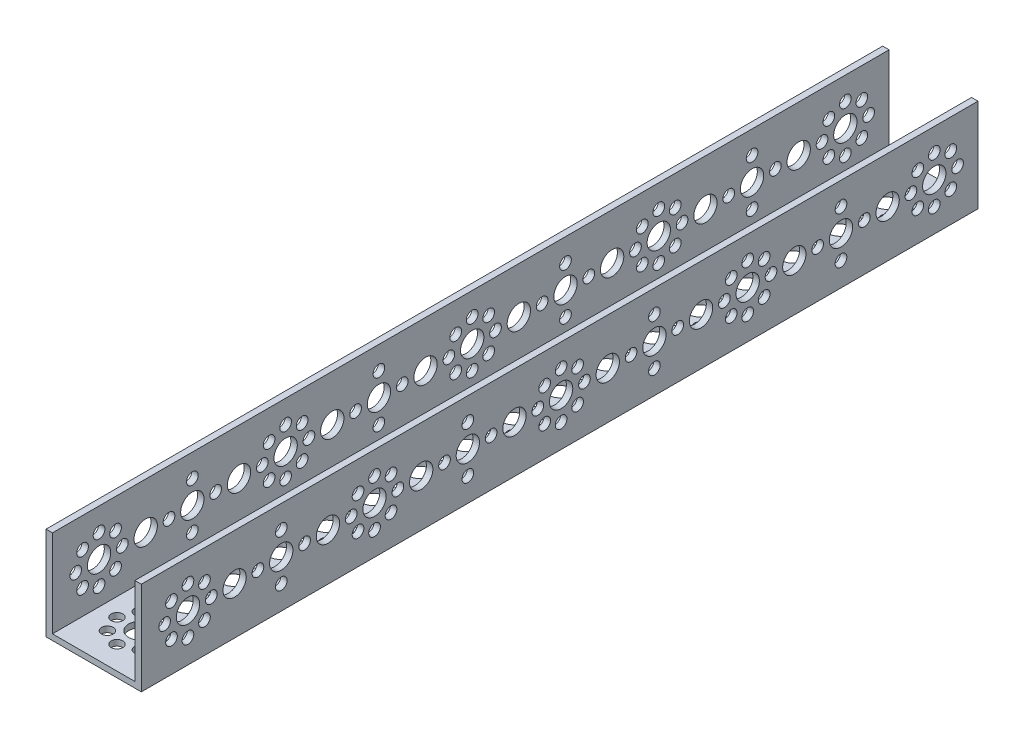
from build123d import *

# Parameters (mm, degrees)
BOSS_EXTRU_1_DEPTH                    = 287
ESQUISSE2_R                           = 4
ENL_V_MAT_EXTRU_1_DEPTH               = 291.623966665
R_P_TITION_LIN_AIRE1_COUNT            = 17
R_P_TITION_LIN_AIRE1_PITCH            = 16
ESQUISSE3_R                           = 2
ENL_V_MAT_EXTRU_2_DEPTH               = 291.623966665
R_P_TITION_CIRCULAIRE1_COUNT          = 4
R_P_TITION_CIRCULAIRE2_COUNT          = 8
R_P_TITION_LIN_AIRE2_COUNT            = 17
R_P_TITION_LIN_AIRE2_PITCH            = 16
R_P_TITION_LIN_AIRE2_COPY_1_SKETCH_R  = 2
R_P_TITION_LIN_AIRE2_COPY_1_DEPTH     = 291.623966665
R_P_TITION_LIN_AIRE2_COPY_2_SKETCH_R  = 2
R_P_TITION_LIN_AIRE2_COPY_2_DEPTH     = 291.623966665
R_P_TITION_LIN_AIRE2_COPY_3_SKETCH_R  = 2
R_P_TITION_LIN_AIRE2_COPY_3_DEPTH     = 291.623966665
R_P_TITION_LIN_AIRE2_COPY_4_SKETCH_R  = 2
R_P_TITION_LIN_AIRE2_COPY_4_DEPTH     = 291.623966665
R_P_TITION_LIN_AIRE2_COPY_5_SKETCH_R  = 2
R_P_TITION_LIN_AIRE2_COPY_5_DEPTH     = 291.623966665
R_P_TITION_LIN_AIRE2_COPY_6_SKETCH_R  = 2
R_P_TITION_LIN_AIRE2_COPY_6_DEPTH     = 291.623966665
R_P_TITION_LIN_AIRE2_COPY_7_SKETCH_R  = 2
R_P_TITION_LIN_AIRE2_COPY_7_DEPTH     = 291.623966665
R_P_TITION_LIN_AIRE2_COPY_8_SKETCH_R  = 2
R_P_TITION_LIN_AIRE2_COPY_8_DEPTH     = 291.623966665
R_P_TITION_LIN_AIRE2_COPY_9_SKETCH_R  = 2
R_P_TITION_LIN_AIRE2_COPY_9_DEPTH     = 291.623966665
R_P_TITION_LIN_AIRE2_COPY_10_SKETCH_R = 2
R_P_TITION_LIN_AIRE2_COPY_10_DEPTH    = 291.623966665
R_P_TITION_LIN_AIRE2_COPY_11_SKETCH_R = 2
R_P_TITION_LIN_AIRE2_COPY_11_DEPTH    = 291.623966665
R_P_TITION_LIN_AIRE2_COPY_12_SKETCH_R = 2
R_P_TITION_LIN_AIRE2_COPY_12_DEPTH    = 291.623966665
R_P_TITION_LIN_AIRE2_COPY_13_SKETCH_R = 2
R_P_TITION_LIN_AIRE2_COPY_13_DEPTH    = 291.623966665
R_P_TITION_LIN_AIRE2_COPY_14_SKETCH_R = 2
R_P_TITION_LIN_AIRE2_COPY_14_DEPTH    = 291.623966665
R_P_TITION_LIN_AIRE2_COPY_15_SKETCH_R = 2
R_P_TITION_LIN_AIRE2_COPY_15_DEPTH    = 291.623966665
R_P_TITION_LIN_AIRE2_COPY_16_SKETCH_R = 2
R_P_TITION_LIN_AIRE2_COPY_16_DEPTH    = 291.623966665
R_P_TITION_LIN_AIRE2_COPY_17_SKETCH_R = 2
R_P_TITION_LIN_AIRE2_COPY_17_DEPTH    = 291.623966665
R_P_TITION_LIN_AIRE2_COPY_18_SKETCH_R = 2
R_P_TITION_LIN_AIRE2_COPY_18_DEPTH    = 291.623966665
R_P_TITION_LIN_AIRE2_COPY_19_SKETCH_R = 2
R_P_TITION_LIN_AIRE2_COPY_19_DEPTH    = 291.623966665
R_P_TITION_LIN_AIRE2_COPY_20_SKETCH_R = 2
R_P_TITION_LIN_AIRE2_COPY_20_DEPTH    = 291.623966665
R_P_TITION_LIN_AIRE2_COPY_21_SKETCH_R = 2
R_P_TITION_LIN_AIRE2_COPY_21_DEPTH    = 291.623966665
R_P_TITION_LIN_AIRE2_COPY_22_SKETCH_R = 2
R_P_TITION_LIN_AIRE2_COPY_22_DEPTH    = 291.623966665
R_P_TITION_LIN_AIRE2_COPY_23_SKETCH_R = 2
R_P_TITION_LIN_AIRE2_COPY_23_DEPTH    = 291.623966665
R_P_TITION_LIN_AIRE2_COPY_24_SKETCH_R = 2
R_P_TITION_LIN_AIRE2_COPY_24_DEPTH    = 291.623966665
R_P_TITION_LIN_AIRE3_COPY_1_SKETCH_R  = 2
R_P_TITION_LIN_AIRE3_COPY_1_DEPTH     = 291.623966665
R_P_TITION_LIN_AIRE3_COPY_2_SKETCH_R  = 2
R_P_TITION_LIN_AIRE3_COPY_2_DEPTH     = 291.623966665
R_P_TITION_LIN_AIRE3_COPY_3_SKETCH_R  = 2
R_P_TITION_LIN_AIRE3_COPY_3_DEPTH     = 291.623966665
R_P_TITION_LIN_AIRE3_COPY_4_SKETCH_R  = 2
R_P_TITION_LIN_AIRE3_COPY_4_DEPTH     = 291.623966665
R_P_TITION_LIN_AIRE3_COPY_5_SKETCH_R  = 2
R_P_TITION_LIN_AIRE3_COPY_5_DEPTH     = 291.623966665
R_P_TITION_LIN_AIRE3_COPY_6_SKETCH_R  = 2
R_P_TITION_LIN_AIRE3_COPY_6_DEPTH     = 291.623966665
R_P_TITION_LIN_AIRE3_COPY_7_SKETCH_R  = 2
R_P_TITION_LIN_AIRE3_COPY_7_DEPTH     = 291.623966665
R_P_TITION_LIN_AIRE3_COPY_8_SKETCH_R  = 2
R_P_TITION_LIN_AIRE3_COPY_8_DEPTH     = 291.623966665
R_P_TITION_LIN_AIRE3_COPY_9_SKETCH_R  = 2
R_P_TITION_LIN_AIRE3_COPY_9_DEPTH     = 291.623966665
R_P_TITION_LIN_AIRE3_COPY_10_SKETCH_R = 2
R_P_TITION_LIN_AIRE3_COPY_10_DEPTH    = 291.623966665
R_P_TITION_LIN_AIRE3_COPY_11_SKETCH_R = 2
R_P_TITION_LIN_AIRE3_COPY_11_DEPTH    = 291.623966665
R_P_TITION_LIN_AIRE3_COPY_12_SKETCH_R = 2
R_P_TITION_LIN_AIRE3_COPY_12_DEPTH    = 291.623966665
R_P_TITION_LIN_AIRE3_COPY_13_SKETCH_R = 2
R_P_TITION_LIN_AIRE3_COPY_13_DEPTH    = 291.623966665
R_P_TITION_LIN_AIRE3_COPY_14_SKETCH_R = 2
R_P_TITION_LIN_AIRE3_COPY_14_DEPTH    = 291.623966665
R_P_TITION_LIN_AIRE3_COPY_15_SKETCH_R = 2
R_P_TITION_LIN_AIRE3_COPY_15_DEPTH    = 291.623966665
R_P_TITION_LIN_AIRE3_COPY_16_SKETCH_R = 2
R_P_TITION_LIN_AIRE3_COPY_16_DEPTH    = 291.623966665
R_P_TITION_LIN_AIRE3_COPY_17_SKETCH_R = 2
R_P_TITION_LIN_AIRE3_COPY_17_DEPTH    = 291.623966665
R_P_TITION_LIN_AIRE3_COPY_18_SKETCH_R = 2
R_P_TITION_LIN_AIRE3_COPY_18_DEPTH    = 291.623966665
R_P_TITION_LIN_AIRE3_COPY_19_SKETCH_R = 2
R_P_TITION_LIN_AIRE3_COPY_19_DEPTH    = 291.623966665
R_P_TITION_LIN_AIRE3_COPY_20_SKETCH_R = 2
R_P_TITION_LIN_AIRE3_COPY_20_DEPTH    = 291.623966665
SYM_TRIE2_COPY_1_SKETCH_R             = 4
SYM_TRIE2_COPY_1_DEPTH                = 291.623966665
SYM_TRIE2_COPY_2_SKETCH_R             = 4
SYM_TRIE2_COPY_2_DEPTH                = 291.623966665
SYM_TRIE2_COPY_3_SKETCH_R             = 4
SYM_TRIE2_COPY_3_DEPTH                = 291.623966665
SYM_TRIE2_COPY_4_SKETCH_R             = 4
SYM_TRIE2_COPY_4_DEPTH                = 291.623966665
SYM_TRIE2_COPY_5_SKETCH_R             = 4
SYM_TRIE2_COPY_5_DEPTH                = 291.623966665
SYM_TRIE2_COPY_6_SKETCH_R             = 4
SYM_TRIE2_COPY_6_DEPTH                = 291.623966665
SYM_TRIE2_COPY_7_SKETCH_R             = 4
SYM_TRIE2_COPY_7_DEPTH                = 291.623966665
SYM_TRIE2_COPY_8_SKETCH_R             = 4
SYM_TRIE2_COPY_8_DEPTH                = 291.623966665
SYM_TRIE2_COPY_9_SKETCH_R             = 4
SYM_TRIE2_COPY_9_DEPTH                = 291.623966665
SYM_TRIE2_COPY_10_SKETCH_R            = 4
SYM_TRIE2_COPY_10_DEPTH               = 291.623966665
SYM_TRIE2_COPY_11_SKETCH_R            = 4
SYM_TRIE2_COPY_11_DEPTH               = 291.623966665
SYM_TRIE2_COPY_12_SKETCH_R            = 4
SYM_TRIE2_COPY_12_DEPTH               = 291.623966665
SYM_TRIE2_COPY_13_SKETCH_R            = 4
SYM_TRIE2_COPY_13_DEPTH               = 291.623966665
SYM_TRIE2_COPY_14_SKETCH_R            = 4
SYM_TRIE2_COPY_14_DEPTH               = 291.623966665
SYM_TRIE2_COPY_15_SKETCH_R            = 4
SYM_TRIE2_COPY_15_DEPTH               = 291.623966665
SYM_TRIE2_COPY_16_SKETCH_R            = 4
SYM_TRIE2_COPY_16_DEPTH               = 291.623966665
SYM_TRIE2_COPY_17_SKETCH_R            = 2
SYM_TRIE2_COPY_17_DEPTH               = 291.623966665
SYM_TRIE2_COPY_18_SKETCH_R            = 2
SYM_TRIE2_COPY_18_DEPTH               = 291.623966665
SYM_TRIE2_COPY_19_SKETCH_R            = 2
SYM_TRIE2_COPY_19_DEPTH               = 291.623966665
SYM_TRIE2_COPY_20_SKETCH_R            = 2
SYM_TRIE2_COPY_20_DEPTH               = 291.623966665
SYM_TRIE2_COPY_21_SKETCH_R            = 2
SYM_TRIE2_COPY_21_DEPTH               = 291.623966665
SYM_TRIE2_COPY_22_SKETCH_R            = 2
SYM_TRIE2_COPY_22_DEPTH               = 291.623966665
SYM_TRIE2_COPY_23_SKETCH_R            = 2
SYM_TRIE2_COPY_23_DEPTH               = 291.623966665
SYM_TRIE2_COPY_24_SKETCH_R            = 2
SYM_TRIE2_COPY_24_DEPTH               = 291.623966665
SYM_TRIE2_COPY_25_SKETCH_R            = 2
SYM_TRIE2_COPY_25_DEPTH               = 291.623966665
SYM_TRIE2_COPY_26_SKETCH_R            = 2
SYM_TRIE2_COPY_26_DEPTH               = 291.623966665
SYM_TRIE2_COPY_27_SKETCH_R            = 2
SYM_TRIE2_COPY_27_DEPTH               = 291.623966665
SYM_TRIE2_COPY_28_SKETCH_R            = 2
SYM_TRIE2_COPY_28_DEPTH               = 291.623966665
SYM_TRIE2_COPY_29_SKETCH_R            = 2
SYM_TRIE2_COPY_29_DEPTH               = 291.623966665
SYM_TRIE2_COPY_30_SKETCH_R            = 2
SYM_TRIE2_COPY_30_DEPTH               = 291.623966665
SYM_TRIE2_COPY_31_SKETCH_R            = 2
SYM_TRIE2_COPY_31_DEPTH               = 291.623966665
SYM_TRIE2_COPY_32_SKETCH_R            = 2
SYM_TRIE2_COPY_32_DEPTH               = 291.623966665
SYM_TRIE2_COPY_33_SKETCH_R            = 2
SYM_TRIE2_COPY_33_DEPTH               = 291.623966665
SYM_TRIE2_COPY_34_SKETCH_R            = 2
SYM_TRIE2_COPY_34_DEPTH               = 291.623966665
SYM_TRIE2_COPY_35_SKETCH_R            = 2
SYM_TRIE2_COPY_35_DEPTH               = 291.623966665
SYM_TRIE2_COPY_36_SKETCH_R            = 2
SYM_TRIE2_COPY_36_DEPTH               = 291.623966665
SYM_TRIE2_COPY_37_SKETCH_R            = 2
SYM_TRIE2_COPY_37_DEPTH               = 291.623966665
SYM_TRIE2_COPY_38_SKETCH_R            = 2
SYM_TRIE2_COPY_38_DEPTH               = 291.623966665
SYM_TRIE2_COPY_39_SKETCH_R            = 2
SYM_TRIE2_COPY_39_DEPTH               = 291.623966665
SYM_TRIE2_COPY_40_SKETCH_R            = 2
SYM_TRIE2_COPY_40_DEPTH               = 291.623966665
SYM_TRIE2_COPY_41_SKETCH_R            = 2
SYM_TRIE2_COPY_41_DEPTH               = 291.623966665
SYM_TRIE2_COPY_42_SKETCH_R            = 2
SYM_TRIE2_COPY_42_DEPTH               = 291.623966665
SYM_TRIE2_COPY_43_SKETCH_R            = 2
SYM_TRIE2_COPY_43_DEPTH               = 291.623966665
SYM_TRIE2_COPY_44_SKETCH_R            = 2
SYM_TRIE2_COPY_44_DEPTH               = 291.623966665
SYM_TRIE2_COPY_45_SKETCH_R            = 2
SYM_TRIE2_COPY_45_DEPTH               = 291.623966665
SYM_TRIE2_COPY_46_SKETCH_R            = 2
SYM_TRIE2_COPY_46_DEPTH               = 291.623966665
SYM_TRIE2_COPY_47_SKETCH_R            = 2
SYM_TRIE2_COPY_47_DEPTH               = 291.623966665
SYM_TRIE2_COPY_48_SKETCH_R            = 2
SYM_TRIE2_COPY_48_DEPTH               = 291.623966665
SYM_TRIE2_COPY_49_SKETCH_R            = 2
SYM_TRIE2_COPY_49_DEPTH               = 291.623966665
SYM_TRIE2_COPY_50_SKETCH_R            = 2
SYM_TRIE2_COPY_50_DEPTH               = 291.623966665
SYM_TRIE2_COPY_51_SKETCH_R            = 2
SYM_TRIE2_COPY_51_DEPTH               = 291.623966665
SYM_TRIE2_COPY_52_SKETCH_R            = 2
SYM_TRIE2_COPY_52_DEPTH               = 291.623966665
SYM_TRIE2_COPY_53_SKETCH_R            = 2
SYM_TRIE2_COPY_53_DEPTH               = 291.623966665
SYM_TRIE2_COPY_54_SKETCH_R            = 2
SYM_TRIE2_COPY_54_DEPTH               = 291.623966665
SYM_TRIE2_COPY_55_SKETCH_R            = 2
SYM_TRIE2_COPY_55_DEPTH               = 291.623966665
SYM_TRIE2_COPY_56_SKETCH_R            = 2
SYM_TRIE2_COPY_56_DEPTH               = 291.623966665
SYM_TRIE2_COPY_57_SKETCH_R            = 2
SYM_TRIE2_COPY_57_DEPTH               = 291.623966665
SYM_TRIE2_COPY_58_SKETCH_R            = 2
SYM_TRIE2_COPY_58_DEPTH               = 291.623966665
SYM_TRIE2_COPY_59_SKETCH_R            = 2
SYM_TRIE2_COPY_59_DEPTH               = 291.623966665
SYM_TRIE2_COPY_60_SKETCH_R            = 2
SYM_TRIE2_COPY_60_DEPTH               = 291.623966665
SYM_TRIE2_COPY_61_SKETCH_R            = 2
SYM_TRIE2_COPY_61_DEPTH               = 291.623966665
SYM_TRIE2_COPY_62_SKETCH_R            = 2
SYM_TRIE2_COPY_62_DEPTH               = 291.623966665
SYM_TRIE2_COPY_63_SKETCH_R            = 2
SYM_TRIE2_COPY_63_DEPTH               = 291.623966665
SYM_TRIE2_COPY_64_SKETCH_R            = 2
SYM_TRIE2_COPY_64_DEPTH               = 291.623966665
SYM_TRIE2_COPY_65_SKETCH_R            = 2
SYM_TRIE2_COPY_65_DEPTH               = 291.623966665
SYM_TRIE2_COPY_66_SKETCH_R            = 2
SYM_TRIE2_COPY_66_DEPTH               = 291.623966665
SYM_TRIE2_COPY_67_SKETCH_R            = 2
SYM_TRIE2_COPY_67_DEPTH               = 291.623966665
SYM_TRIE2_COPY_68_SKETCH_R            = 2
SYM_TRIE2_COPY_68_DEPTH               = 291.623966665
SYM_TRIE2_COPY_69_SKETCH_R            = 2
SYM_TRIE2_COPY_69_DEPTH               = 291.623966665
SYM_TRIE2_COPY_70_SKETCH_R            = 2
SYM_TRIE2_COPY_70_DEPTH               = 291.623966665
SYM_TRIE2_COPY_71_SKETCH_R            = 2
SYM_TRIE2_COPY_71_DEPTH               = 291.623966665
SYM_TRIE2_COPY_72_SKETCH_R            = 2
SYM_TRIE2_COPY_72_DEPTH               = 291.623966665
SYM_TRIE2_COPY_73_SKETCH_R            = 2
SYM_TRIE2_COPY_73_DEPTH               = 291.623966665
SYM_TRIE2_COPY_74_SKETCH_R            = 2
SYM_TRIE2_COPY_74_DEPTH               = 291.623966665
SYM_TRIE2_COPY_75_SKETCH_R            = 2
SYM_TRIE2_COPY_75_DEPTH               = 291.623966665


with BuildPart() as part:
    # Esquisse1 → Boss.-Extru.1 (new body)
    with BuildSketch(Plane.XY):
        Polygon((0, 0), (0, 32), (2.2, 32), (2.2, 2), (30.5, 2), (30.5, 32), (32.7, 32), (32.7, 0), align=None)
    extrude(amount=BOSS_EXTRU_1_DEPTH)

    # Esquisse2 → Enlèv. mat.-Extru.1 (cut, symmetric)
    with BuildSketch(Plane(origin=(0, 0, 0), x_dir=(-1, 0, 0), z_dir=(0, -1, 0))):
        with Locations(Location((-16.35, -271, 0), (0, 0, 90))):
            Circle(ESQUISSE2_R)
    enl_v_mat_extru_1 = extrude(amount=ENL_V_MAT_EXTRU_1_DEPTH, both=True, mode=Mode.SUBTRACT)

    # Répétition linéaire1: Enlèv. mat.-Extru.1 ×17
    with Locations(*[(0, 0, -i * R_P_TITION_LIN_AIRE1_PITCH) for i in range(1, R_P_TITION_LIN_AIRE1_COUNT)]):
        add(enl_v_mat_extru_1, mode=Mode.SUBTRACT)

    # Esquisse3 → Enlèv. mat.-Extru.2 (cut, symmetric)
    with BuildSketch(Plane.XZ):
        with Locations(Location((24.35, 271, 0), (0, 0, 270))):
            Circle(ESQUISSE3_R)
    enl_v_mat_extru_2 = extrude(amount=ENL_V_MAT_EXTRU_2_DEPTH, both=True, mode=Mode.SUBTRACT)

    # Répétition circulaire1: Enlèv. mat.-Extru.2 ×4 about axis
    r_p_tition_circulaire1_axis = Axis((16.35, 0, 271), (0, 1, 0))
    for i in range(1, R_P_TITION_CIRCULAIRE1_COUNT):
        add(enl_v_mat_extru_2.rotate(r_p_tition_circulaire1_axis, i * 360 / R_P_TITION_CIRCULAIRE1_COUNT), mode=Mode.SUBTRACT)

    # Répétition circulaire2: Enlèv. mat.-Extru.2 ×8 about axis, 3 skipped
    r_p_tition_circulaire2_axis = Axis((16.35, 0, 271), (0, 1, 0))
    add([enl_v_mat_extru_2.rotate(r_p_tition_circulaire2_axis, i * 360 / R_P_TITION_CIRCULAIRE2_COUNT) for i in range(1, R_P_TITION_CIRCULAIRE2_COUNT) if i not in (2, 4, 6)], mode=Mode.SUBTRACT)

    # Répétition linéaire2: Enlèv. mat.-Extru.2 ×17, 8 skipped
    with Locations(*[(0, 0, -i * R_P_TITION_LIN_AIRE2_PITCH) for i in range(1, R_P_TITION_LIN_AIRE2_COUNT) if i not in (1, 3, 5, 7, 9, 11, 13, 15)]):
        add(enl_v_mat_extru_2, mode=Mode.SUBTRACT)

    # Répétition linéaire2 copy 1 sketch → Répétition linéaire2 copy 1 (cut, symmetric)
    with BuildSketch(Plane(origin=(-254.65, 0, 255.35), x_dir=(0, 0, -1), z_dir=(0, -1, 0))):
        with Locations(Location((24.35, 271, 0), (0, 0, 270))):
            Circle(R_P_TITION_LIN_AIRE2_COPY_1_SKETCH_R)
    extrude(amount=R_P_TITION_LIN_AIRE2_COPY_1_DEPTH, both=True, mode=Mode.SUBTRACT)

    # Répétition linéaire2 copy 2 sketch → Répétition linéaire2 copy 2 (cut, symmetric)
    with BuildSketch(Plane(origin=(-254.65, 0, 223.35), x_dir=(0, 0, -1), z_dir=(0, -1, 0))):
        with Locations(Location((24.35, 271, 0), (0, 0, 270))):
            Circle(R_P_TITION_LIN_AIRE2_COPY_2_SKETCH_R)
    extrude(amount=R_P_TITION_LIN_AIRE2_COPY_2_DEPTH, both=True, mode=Mode.SUBTRACT)

    # Répétition linéaire2 copy 3 sketch → Répétition linéaire2 copy 3 (cut, symmetric)
    with BuildSketch(Plane(origin=(-254.65, 0, 191.35), x_dir=(0, 0, -1), z_dir=(0, -1, 0))):
        with Locations(Location((24.35, 271, 0), (0, 0, 270))):
            Circle(R_P_TITION_LIN_AIRE2_COPY_3_SKETCH_R)
    extrude(amount=R_P_TITION_LIN_AIRE2_COPY_3_DEPTH, both=True, mode=Mode.SUBTRACT)

    # Répétition linéaire2 copy 4 sketch → Répétition linéaire2 copy 4 (cut, symmetric)
    with BuildSketch(Plane(origin=(-254.65, 0, 159.35), x_dir=(0, 0, -1), z_dir=(0, -1, 0))):
        with Locations(Location((24.35, 271, 0), (0, 0, 270))):
            Circle(R_P_TITION_LIN_AIRE2_COPY_4_SKETCH_R)
    extrude(amount=R_P_TITION_LIN_AIRE2_COPY_4_DEPTH, both=True, mode=Mode.SUBTRACT)

    # Répétition linéaire2 copy 5 sketch → Répétition linéaire2 copy 5 (cut, symmetric)
    with BuildSketch(Plane(origin=(-254.65, 0, 127.35), x_dir=(0, 0, -1), z_dir=(0, -1, 0))):
        with Locations(Location((24.35, 271, 0), (0, 0, 270))):
            Circle(R_P_TITION_LIN_AIRE2_COPY_5_SKETCH_R)
    extrude(amount=R_P_TITION_LIN_AIRE2_COPY_5_DEPTH, both=True, mode=Mode.SUBTRACT)

    # Répétition linéaire2 copy 6 sketch → Répétition linéaire2 copy 6 (cut, symmetric)
    with BuildSketch(Plane(origin=(-254.65, 0, 95.35), x_dir=(0, 0, -1), z_dir=(0, -1, 0))):
        with Locations(Location((24.35, 271, 0), (0, 0, 270))):
            Circle(R_P_TITION_LIN_AIRE2_COPY_6_SKETCH_R)
    extrude(amount=R_P_TITION_LIN_AIRE2_COPY_6_DEPTH, both=True, mode=Mode.SUBTRACT)

    # Répétition linéaire2 copy 7 sketch → Répétition linéaire2 copy 7 (cut, symmetric)
    with BuildSketch(Plane(origin=(-254.65, 0, 63.35), x_dir=(0, 0, -1), z_dir=(0, -1, 0))):
        with Locations(Location((24.35, 271, 0), (0, 0, 270))):
            Circle(R_P_TITION_LIN_AIRE2_COPY_7_SKETCH_R)
    extrude(amount=R_P_TITION_LIN_AIRE2_COPY_7_DEPTH, both=True, mode=Mode.SUBTRACT)

    # Répétition linéaire2 copy 8 sketch → Répétition linéaire2 copy 8 (cut, symmetric)
    with BuildSketch(Plane(origin=(-254.65, 0, 31.35), x_dir=(0, 0, -1), z_dir=(0, -1, 0))):
        with Locations(Location((24.35, 271, 0), (0, 0, 270))):
            Circle(R_P_TITION_LIN_AIRE2_COPY_8_SKETCH_R)
    extrude(amount=R_P_TITION_LIN_AIRE2_COPY_8_DEPTH, both=True, mode=Mode.SUBTRACT)

    # Répétition linéaire2 copy 9 sketch → Répétition linéaire2 copy 9 (cut, symmetric)
    with BuildSketch(Plane(origin=(32.7, 0, 510), x_dir=(-1, 0, 0), z_dir=(0, -1, 0))):
        with Locations(Location((24.35, 271, 0), (0, 0, 270))):
            Circle(R_P_TITION_LIN_AIRE2_COPY_9_SKETCH_R)
    extrude(amount=R_P_TITION_LIN_AIRE2_COPY_9_DEPTH, both=True, mode=Mode.SUBTRACT)

    # Répétition linéaire2 copy 10 sketch → Répétition linéaire2 copy 10 (cut, symmetric)
    with BuildSketch(Plane(origin=(32.7, 0, 478), x_dir=(-1, 0, 0), z_dir=(0, -1, 0))):
        with Locations(Location((24.35, 271, 0), (0, 0, 270))):
            Circle(R_P_TITION_LIN_AIRE2_COPY_10_SKETCH_R)
    extrude(amount=R_P_TITION_LIN_AIRE2_COPY_10_DEPTH, both=True, mode=Mode.SUBTRACT)

    # Répétition linéaire2 copy 11 sketch → Répétition linéaire2 copy 11 (cut, symmetric)
    with BuildSketch(Plane(origin=(32.7, 0, 446), x_dir=(-1, 0, 0), z_dir=(0, -1, 0))):
        with Locations(Location((24.35, 271, 0), (0, 0, 270))):
            Circle(R_P_TITION_LIN_AIRE2_COPY_11_SKETCH_R)
    extrude(amount=R_P_TITION_LIN_AIRE2_COPY_11_DEPTH, both=True, mode=Mode.SUBTRACT)

    # Répétition linéaire2 copy 12 sketch → Répétition linéaire2 copy 12 (cut, symmetric)
    with BuildSketch(Plane(origin=(32.7, 0, 414), x_dir=(-1, 0, 0), z_dir=(0, -1, 0))):
        with Locations(Location((24.35, 271, 0), (0, 0, 270))):
            Circle(R_P_TITION_LIN_AIRE2_COPY_12_SKETCH_R)
    extrude(amount=R_P_TITION_LIN_AIRE2_COPY_12_DEPTH, both=True, mode=Mode.SUBTRACT)

    # Répétition linéaire2 copy 13 sketch → Répétition linéaire2 copy 13 (cut, symmetric)
    with BuildSketch(Plane(origin=(32.7, 0, 382), x_dir=(-1, 0, 0), z_dir=(0, -1, 0))):
        with Locations(Location((24.35, 271, 0), (0, 0, 270))):
            Circle(R_P_TITION_LIN_AIRE2_COPY_13_SKETCH_R)
    extrude(amount=R_P_TITION_LIN_AIRE2_COPY_13_DEPTH, both=True, mode=Mode.SUBTRACT)

    # Répétition linéaire2 copy 14 sketch → Répétition linéaire2 copy 14 (cut, symmetric)
    with BuildSketch(Plane(origin=(32.7, 0, 350), x_dir=(-1, 0, 0), z_dir=(0, -1, 0))):
        with Locations(Location((24.35, 271, 0), (0, 0, 270))):
            Circle(R_P_TITION_LIN_AIRE2_COPY_14_SKETCH_R)
    extrude(amount=R_P_TITION_LIN_AIRE2_COPY_14_DEPTH, both=True, mode=Mode.SUBTRACT)

    # Répétition linéaire2 copy 15 sketch → Répétition linéaire2 copy 15 (cut, symmetric)
    with BuildSketch(Plane(origin=(32.7, 0, 318), x_dir=(-1, 0, 0), z_dir=(0, -1, 0))):
        with Locations(Location((24.35, 271, 0), (0, 0, 270))):
            Circle(R_P_TITION_LIN_AIRE2_COPY_15_SKETCH_R)
    extrude(amount=R_P_TITION_LIN_AIRE2_COPY_15_DEPTH, both=True, mode=Mode.SUBTRACT)

    # Répétition linéaire2 copy 16 sketch → Répétition linéaire2 copy 16 (cut, symmetric)
    with BuildSketch(Plane(origin=(32.7, 0, 286), x_dir=(-1, 0, 0), z_dir=(0, -1, 0))):
        with Locations(Location((24.35, 271, 0), (0, 0, 270))):
            Circle(R_P_TITION_LIN_AIRE2_COPY_16_SKETCH_R)
    extrude(amount=R_P_TITION_LIN_AIRE2_COPY_16_DEPTH, both=True, mode=Mode.SUBTRACT)

    # Répétition linéaire2 copy 17 sketch → Répétition linéaire2 copy 17 (cut, symmetric)
    with BuildSketch(Plane(origin=(287.35, 0, 222.65), x_dir=(0, 0, 1), z_dir=(0, -1, 0))):
        with Locations(Location((24.35, 271, 0), (0, 0, 270))):
            Circle(R_P_TITION_LIN_AIRE2_COPY_17_SKETCH_R)
    extrude(amount=R_P_TITION_LIN_AIRE2_COPY_17_DEPTH, both=True, mode=Mode.SUBTRACT)

    # Répétition linéaire2 copy 18 sketch → Répétition linéaire2 copy 18 (cut, symmetric)
    with BuildSketch(Plane(origin=(287.35, 0, 190.65), x_dir=(0, 0, 1), z_dir=(0, -1, 0))):
        with Locations(Location((24.35, 271, 0), (0, 0, 270))):
            Circle(R_P_TITION_LIN_AIRE2_COPY_18_SKETCH_R)
    extrude(amount=R_P_TITION_LIN_AIRE2_COPY_18_DEPTH, both=True, mode=Mode.SUBTRACT)

    # Répétition linéaire2 copy 19 sketch → Répétition linéaire2 copy 19 (cut, symmetric)
    with BuildSketch(Plane(origin=(287.35, 0, 158.65), x_dir=(0, 0, 1), z_dir=(0, -1, 0))):
        with Locations(Location((24.35, 271, 0), (0, 0, 270))):
            Circle(R_P_TITION_LIN_AIRE2_COPY_19_SKETCH_R)
    extrude(amount=R_P_TITION_LIN_AIRE2_COPY_19_DEPTH, both=True, mode=Mode.SUBTRACT)

    # Répétition linéaire2 copy 20 sketch → Répétition linéaire2 copy 20 (cut, symmetric)
    with BuildSketch(Plane(origin=(287.35, 0, 126.65), x_dir=(0, 0, 1), z_dir=(0, -1, 0))):
        with Locations(Location((24.35, 271, 0), (0, 0, 270))):
            Circle(R_P_TITION_LIN_AIRE2_COPY_20_SKETCH_R)
    extrude(amount=R_P_TITION_LIN_AIRE2_COPY_20_DEPTH, both=True, mode=Mode.SUBTRACT)

    # Répétition linéaire2 copy 21 sketch → Répétition linéaire2 copy 21 (cut, symmetric)
    with BuildSketch(Plane(origin=(287.35, 0, 94.65), x_dir=(0, 0, 1), z_dir=(0, -1, 0))):
        with Locations(Location((24.35, 271, 0), (0, 0, 270))):
            Circle(R_P_TITION_LIN_AIRE2_COPY_21_SKETCH_R)
    extrude(amount=R_P_TITION_LIN_AIRE2_COPY_21_DEPTH, both=True, mode=Mode.SUBTRACT)

    # Répétition linéaire2 copy 22 sketch → Répétition linéaire2 copy 22 (cut, symmetric)
    with BuildSketch(Plane(origin=(287.35, 0, 62.65), x_dir=(0, 0, 1), z_dir=(0, -1, 0))):
        with Locations(Location((24.35, 271, 0), (0, 0, 270))):
            Circle(R_P_TITION_LIN_AIRE2_COPY_22_SKETCH_R)
    extrude(amount=R_P_TITION_LIN_AIRE2_COPY_22_DEPTH, both=True, mode=Mode.SUBTRACT)

    # Répétition linéaire2 copy 23 sketch → Répétition linéaire2 copy 23 (cut, symmetric)
    with BuildSketch(Plane(origin=(287.35, 0, 30.65), x_dir=(0, 0, 1), z_dir=(0, -1, 0))):
        with Locations(Location((24.35, 271, 0), (0, 0, 270))):
            Circle(R_P_TITION_LIN_AIRE2_COPY_23_SKETCH_R)
    extrude(amount=R_P_TITION_LIN_AIRE2_COPY_23_DEPTH, both=True, mode=Mode.SUBTRACT)

    # Répétition linéaire2 copy 24 sketch → Répétition linéaire2 copy 24 (cut, symmetric)
    with BuildSketch(Plane(origin=(287.35, 0, -1.35), x_dir=(0, 0, 1), z_dir=(0, -1, 0))):
        with Locations(Location((24.35, 271, 0), (0, 0, 270))):
            Circle(R_P_TITION_LIN_AIRE2_COPY_24_SKETCH_R)
    extrude(amount=R_P_TITION_LIN_AIRE2_COPY_24_DEPTH, both=True, mode=Mode.SUBTRACT)

    # Répétition linéaire3 copy 1 sketch → Répétition linéaire3 copy 1 (cut, symmetric)
    with BuildSketch(Plane(origin=(-186.837133574, 0, 26.935258171), x_dir=(0.7071067811865476, 0, -0.7071067811865475), z_dir=(0, -1, 0))):
        with Locations(Location((24.35, 271, 0), (0, 0, 270))):
            Circle(R_P_TITION_LIN_AIRE3_COPY_1_SKETCH_R)
    extrude(amount=R_P_TITION_LIN_AIRE3_COPY_1_DEPTH, both=True, mode=Mode.SUBTRACT)

    # Répétition linéaire3 copy 2 sketch → Répétition linéaire3 copy 2 (cut, symmetric)
    with BuildSketch(Plane(origin=(-186.837133574, 0, -37.064741829), x_dir=(0.7071067811865476, 0, -0.7071067811865475), z_dir=(0, -1, 0))):
        with Locations(Location((24.35, 271, 0), (0, 0, 270))):
            Circle(R_P_TITION_LIN_AIRE3_COPY_2_SKETCH_R)
    extrude(amount=R_P_TITION_LIN_AIRE3_COPY_2_DEPTH, both=True, mode=Mode.SUBTRACT)

    # Répétition linéaire3 copy 3 sketch → Répétition linéaire3 copy 3 (cut, symmetric)
    with BuildSketch(Plane(origin=(-186.837133574, 0, -101.064741829), x_dir=(0.7071067811865476, 0, -0.7071067811865475), z_dir=(0, -1, 0))):
        with Locations(Location((24.35, 271, 0), (0, 0, 270))):
            Circle(R_P_TITION_LIN_AIRE3_COPY_3_SKETCH_R)
    extrude(amount=R_P_TITION_LIN_AIRE3_COPY_3_DEPTH, both=True, mode=Mode.SUBTRACT)

    # Répétition linéaire3 copy 4 sketch → Répétition linéaire3 copy 4 (cut, symmetric)
    with BuildSketch(Plane(origin=(-186.837133574, 0, -165.064741829), x_dir=(0.7071067811865476, 0, -0.7071067811865475), z_dir=(0, -1, 0))):
        with Locations(Location((24.35, 271, 0), (0, 0, 270))):
            Circle(R_P_TITION_LIN_AIRE3_COPY_4_SKETCH_R)
    extrude(amount=R_P_TITION_LIN_AIRE3_COPY_4_DEPTH, both=True, mode=Mode.SUBTRACT)

    # Répétition linéaire3 copy 5 sketch → Répétition linéaire3 copy 5 (cut, symmetric)
    with BuildSketch(Plane(origin=(-163.714741829, 0, 410.187133574), x_dir=(-0.7071067811865475, 0, -0.7071067811865476), z_dir=(0, -1, 0))):
        with Locations(Location((24.35, 271, 0), (0, 0, 270))):
            Circle(R_P_TITION_LIN_AIRE3_COPY_5_SKETCH_R)
    extrude(amount=R_P_TITION_LIN_AIRE3_COPY_5_DEPTH, both=True, mode=Mode.SUBTRACT)

    # Répétition linéaire3 copy 6 sketch → Répétition linéaire3 copy 6 (cut, symmetric)
    with BuildSketch(Plane(origin=(-163.714741829, 0, 346.187133574), x_dir=(-0.7071067811865475, 0, -0.7071067811865476), z_dir=(0, -1, 0))):
        with Locations(Location((24.35, 271, 0), (0, 0, 270))):
            Circle(R_P_TITION_LIN_AIRE3_COPY_6_SKETCH_R)
    extrude(amount=R_P_TITION_LIN_AIRE3_COPY_6_DEPTH, both=True, mode=Mode.SUBTRACT)

    # Répétition linéaire3 copy 7 sketch → Répétition linéaire3 copy 7 (cut, symmetric)
    with BuildSketch(Plane(origin=(-163.714741829, 0, 282.187133574), x_dir=(-0.7071067811865475, 0, -0.7071067811865476), z_dir=(0, -1, 0))):
        with Locations(Location((24.35, 271, 0), (0, 0, 270))):
            Circle(R_P_TITION_LIN_AIRE3_COPY_7_SKETCH_R)
    extrude(amount=R_P_TITION_LIN_AIRE3_COPY_7_DEPTH, both=True, mode=Mode.SUBTRACT)

    # Répétition linéaire3 copy 8 sketch → Répétition linéaire3 copy 8 (cut, symmetric)
    with BuildSketch(Plane(origin=(-163.714741829, 0, 218.187133574), x_dir=(-0.7071067811865475, 0, -0.7071067811865476), z_dir=(0, -1, 0))):
        with Locations(Location((24.35, 271, 0), (0, 0, 270))):
            Circle(R_P_TITION_LIN_AIRE3_COPY_8_SKETCH_R)
    extrude(amount=R_P_TITION_LIN_AIRE3_COPY_8_DEPTH, both=True, mode=Mode.SUBTRACT)

    # Répétition linéaire3 copy 9 sketch → Répétition linéaire3 copy 9 (cut, symmetric)
    with BuildSketch(Plane(origin=(219.537133574, 0, 387.064741829), x_dir=(-0.7071067811865477, 0, 0.7071067811865475), z_dir=(0, -1, 0))):
        with Locations(Location((24.35, 271, 0), (0, 0, 270))):
            Circle(R_P_TITION_LIN_AIRE3_COPY_9_SKETCH_R)
    extrude(amount=R_P_TITION_LIN_AIRE3_COPY_9_DEPTH, both=True, mode=Mode.SUBTRACT)

    # Répétition linéaire3 copy 10 sketch → Répétition linéaire3 copy 10 (cut, symmetric)
    with BuildSketch(Plane(origin=(219.537133574, 0, 323.064741829), x_dir=(-0.7071067811865477, 0, 0.7071067811865475), z_dir=(0, -1, 0))):
        with Locations(Location((24.35, 271, 0), (0, 0, 270))):
            Circle(R_P_TITION_LIN_AIRE3_COPY_10_SKETCH_R)
    extrude(amount=R_P_TITION_LIN_AIRE3_COPY_10_DEPTH, both=True, mode=Mode.SUBTRACT)

    # Répétition linéaire3 copy 11 sketch → Répétition linéaire3 copy 11 (cut, symmetric)
    with BuildSketch(Plane(origin=(219.537133574, 0, 259.064741829), x_dir=(-0.7071067811865477, 0, 0.7071067811865475), z_dir=(0, -1, 0))):
        with Locations(Location((24.35, 271, 0), (0, 0, 270))):
            Circle(R_P_TITION_LIN_AIRE3_COPY_11_SKETCH_R)
    extrude(amount=R_P_TITION_LIN_AIRE3_COPY_11_DEPTH, both=True, mode=Mode.SUBTRACT)

    # Répétition linéaire3 copy 12 sketch → Répétition linéaire3 copy 12 (cut, symmetric)
    with BuildSketch(Plane(origin=(219.537133574, 0, 195.064741829), x_dir=(-0.7071067811865477, 0, 0.7071067811865475), z_dir=(0, -1, 0))):
        with Locations(Location((24.35, 271, 0), (0, 0, 270))):
            Circle(R_P_TITION_LIN_AIRE3_COPY_12_SKETCH_R)
    extrude(amount=R_P_TITION_LIN_AIRE3_COPY_12_DEPTH, both=True, mode=Mode.SUBTRACT)

    # Répétition linéaire3 copy 13 sketch → Répétition linéaire3 copy 13 (cut, symmetric)
    with BuildSketch(Plane(origin=(196.414741829, 0, 3.812866426), x_dir=(0.7071067811865474, 0, 0.7071067811865477), z_dir=(0, -1, 0))):
        with Locations(Location((24.35, 271, 0), (0, 0, 270))):
            Circle(R_P_TITION_LIN_AIRE3_COPY_13_SKETCH_R)
    extrude(amount=R_P_TITION_LIN_AIRE3_COPY_13_DEPTH, both=True, mode=Mode.SUBTRACT)

    # Répétition linéaire3 copy 14 sketch → Répétition linéaire3 copy 14 (cut, symmetric)
    with BuildSketch(Plane(origin=(196.414741829, 0, -60.187133574), x_dir=(0.7071067811865474, 0, 0.7071067811865477), z_dir=(0, -1, 0))):
        with Locations(Location((24.35, 271, 0), (0, 0, 270))):
            Circle(R_P_TITION_LIN_AIRE3_COPY_14_SKETCH_R)
    extrude(amount=R_P_TITION_LIN_AIRE3_COPY_14_DEPTH, both=True, mode=Mode.SUBTRACT)

    # Répétition linéaire3 copy 15 sketch → Répétition linéaire3 copy 15 (cut, symmetric)
    with BuildSketch(Plane(origin=(196.414741829, 0, -124.187133574), x_dir=(0.7071067811865474, 0, 0.7071067811865477), z_dir=(0, -1, 0))):
        with Locations(Location((24.35, 271, 0), (0, 0, 270))):
            Circle(R_P_TITION_LIN_AIRE3_COPY_15_SKETCH_R)
    extrude(amount=R_P_TITION_LIN_AIRE3_COPY_15_DEPTH, both=True, mode=Mode.SUBTRACT)

    # Répétition linéaire3 copy 16 sketch → Répétition linéaire3 copy 16 (cut, symmetric)
    with BuildSketch(Plane(origin=(196.414741829, 0, -188.187133574), x_dir=(0.7071067811865474, 0, 0.7071067811865477), z_dir=(0, -1, 0))):
        with Locations(Location((24.35, 271, 0), (0, 0, 270))):
            Circle(R_P_TITION_LIN_AIRE3_COPY_16_SKETCH_R)
    extrude(amount=R_P_TITION_LIN_AIRE3_COPY_16_DEPTH, both=True, mode=Mode.SUBTRACT)

    # Répétition linéaire3 copy 17 sketch → Répétition linéaire3 copy 17 (cut, symmetric)
    with BuildSketch(Plane(origin=(0, 0, -64), x_dir=(1, 0, 0), z_dir=(0, -1, 0))):
        with Locations(Location((24.35, 271, 0), (0, 0, 270))):
            Circle(R_P_TITION_LIN_AIRE3_COPY_17_SKETCH_R)
    extrude(amount=R_P_TITION_LIN_AIRE3_COPY_17_DEPTH, both=True, mode=Mode.SUBTRACT)

    # Répétition linéaire3 copy 18 sketch → Répétition linéaire3 copy 18 (cut, symmetric)
    with BuildSketch(Plane(origin=(0, 0, -128), x_dir=(1, 0, 0), z_dir=(0, -1, 0))):
        with Locations(Location((24.35, 271, 0), (0, 0, 270))):
            Circle(R_P_TITION_LIN_AIRE3_COPY_18_SKETCH_R)
    extrude(amount=R_P_TITION_LIN_AIRE3_COPY_18_DEPTH, both=True, mode=Mode.SUBTRACT)

    # Répétition linéaire3 copy 19 sketch → Répétition linéaire3 copy 19 (cut, symmetric)
    with BuildSketch(Plane(origin=(0, 0, -192), x_dir=(1, 0, 0), z_dir=(0, -1, 0))):
        with Locations(Location((24.35, 271, 0), (0, 0, 270))):
            Circle(R_P_TITION_LIN_AIRE3_COPY_19_SKETCH_R)
    extrude(amount=R_P_TITION_LIN_AIRE3_COPY_19_DEPTH, both=True, mode=Mode.SUBTRACT)

    # Répétition linéaire3 copy 20 sketch → Répétition linéaire3 copy 20 (cut, symmetric)
    with BuildSketch(Plane(origin=(0, 0, -256), x_dir=(1, 0, 0), z_dir=(0, -1, 0))):
        with Locations(Location((24.35, 271, 0), (0, 0, 270))):
            Circle(R_P_TITION_LIN_AIRE3_COPY_20_SKETCH_R)
    extrude(amount=R_P_TITION_LIN_AIRE3_COPY_20_DEPTH, both=True, mode=Mode.SUBTRACT)

    # Symétrie2: Enlèv. mat.-Extru.1, Enlèv. mat.-Extru.2 across plane
    add(enl_v_mat_extru_1.mirror(Plane(origin=(0.1, -0.1, 0), x_dir=(0, 0, 1), z_dir=(0.7071067811865477, -0.7071067811865475, 0))), mode=Mode.SUBTRACT)
    add(enl_v_mat_extru_2.mirror(Plane(origin=(0.1, -0.1, 0), x_dir=(0, 0, 1), z_dir=(0.7071067811865477, -0.7071067811865475, 0))), mode=Mode.SUBTRACT)

    # Symétrie2 copy 1 sketch → Symétrie2 copy 1 (cut, symmetric)
    with BuildSketch(Plane(origin=(0.2, -0.2, -16), x_dir=(0, -1, 0), z_dir=(-1, 0, 0))):
        with Locations((-16.35, 271)):
            Circle(SYM_TRIE2_COPY_1_SKETCH_R)
    extrude(amount=SYM_TRIE2_COPY_1_DEPTH, both=True, mode=Mode.SUBTRACT)

    # Symétrie2 copy 2 sketch → Symétrie2 copy 2 (cut, symmetric)
    with BuildSketch(Plane(origin=(0.2, -0.2, -32), x_dir=(0, -1, 0), z_dir=(-1, 0, 0))):
        with Locations((-16.35, 271)):
            Circle(SYM_TRIE2_COPY_2_SKETCH_R)
    extrude(amount=SYM_TRIE2_COPY_2_DEPTH, both=True, mode=Mode.SUBTRACT)

    # Symétrie2 copy 3 sketch → Symétrie2 copy 3 (cut, symmetric)
    with BuildSketch(Plane(origin=(0.2, -0.2, -48), x_dir=(0, -1, 0), z_dir=(-1, 0, 0))):
        with Locations((-16.35, 271)):
            Circle(SYM_TRIE2_COPY_3_SKETCH_R)
    extrude(amount=SYM_TRIE2_COPY_3_DEPTH, both=True, mode=Mode.SUBTRACT)

    # Symétrie2 copy 4 sketch → Symétrie2 copy 4 (cut, symmetric)
    with BuildSketch(Plane(origin=(0.2, -0.2, -64), x_dir=(0, -1, 0), z_dir=(-1, 0, 0))):
        with Locations((-16.35, 271)):
            Circle(SYM_TRIE2_COPY_4_SKETCH_R)
    extrude(amount=SYM_TRIE2_COPY_4_DEPTH, both=True, mode=Mode.SUBTRACT)

    # Symétrie2 copy 5 sketch → Symétrie2 copy 5 (cut, symmetric)
    with BuildSketch(Plane(origin=(0.2, -0.2, -80), x_dir=(0, -1, 0), z_dir=(-1, 0, 0))):
        with Locations((-16.35, 271)):
            Circle(SYM_TRIE2_COPY_5_SKETCH_R)
    extrude(amount=SYM_TRIE2_COPY_5_DEPTH, both=True, mode=Mode.SUBTRACT)

    # Symétrie2 copy 6 sketch → Symétrie2 copy 6 (cut, symmetric)
    with BuildSketch(Plane(origin=(0.2, -0.2, -96), x_dir=(0, -1, 0), z_dir=(-1, 0, 0))):
        with Locations((-16.35, 271)):
            Circle(SYM_TRIE2_COPY_6_SKETCH_R)
    extrude(amount=SYM_TRIE2_COPY_6_DEPTH, both=True, mode=Mode.SUBTRACT)

    # Symétrie2 copy 7 sketch → Symétrie2 copy 7 (cut, symmetric)
    with BuildSketch(Plane(origin=(0.2, -0.2, -112), x_dir=(0, -1, 0), z_dir=(-1, 0, 0))):
        with Locations((-16.35, 271)):
            Circle(SYM_TRIE2_COPY_7_SKETCH_R)
    extrude(amount=SYM_TRIE2_COPY_7_DEPTH, both=True, mode=Mode.SUBTRACT)

    # Symétrie2 copy 8 sketch → Symétrie2 copy 8 (cut, symmetric)
    with BuildSketch(Plane(origin=(0.2, -0.2, -128), x_dir=(0, -1, 0), z_dir=(-1, 0, 0))):
        with Locations((-16.35, 271)):
            Circle(SYM_TRIE2_COPY_8_SKETCH_R)
    extrude(amount=SYM_TRIE2_COPY_8_DEPTH, both=True, mode=Mode.SUBTRACT)

    # Symétrie2 copy 9 sketch → Symétrie2 copy 9 (cut, symmetric)
    with BuildSketch(Plane(origin=(0.2, -0.2, -144), x_dir=(0, -1, 0), z_dir=(-1, 0, 0))):
        with Locations((-16.35, 271)):
            Circle(SYM_TRIE2_COPY_9_SKETCH_R)
    extrude(amount=SYM_TRIE2_COPY_9_DEPTH, both=True, mode=Mode.SUBTRACT)

    # Symétrie2 copy 10 sketch → Symétrie2 copy 10 (cut, symmetric)
    with BuildSketch(Plane(origin=(0.2, -0.2, -160), x_dir=(0, -1, 0), z_dir=(-1, 0, 0))):
        with Locations((-16.35, 271)):
            Circle(SYM_TRIE2_COPY_10_SKETCH_R)
    extrude(amount=SYM_TRIE2_COPY_10_DEPTH, both=True, mode=Mode.SUBTRACT)

    # Symétrie2 copy 11 sketch → Symétrie2 copy 11 (cut, symmetric)
    with BuildSketch(Plane(origin=(0.2, -0.2, -176), x_dir=(0, -1, 0), z_dir=(-1, 0, 0))):
        with Locations((-16.35, 271)):
            Circle(SYM_TRIE2_COPY_11_SKETCH_R)
    extrude(amount=SYM_TRIE2_COPY_11_DEPTH, both=True, mode=Mode.SUBTRACT)

    # Symétrie2 copy 12 sketch → Symétrie2 copy 12 (cut, symmetric)
    with BuildSketch(Plane(origin=(0.2, -0.2, -192), x_dir=(0, -1, 0), z_dir=(-1, 0, 0))):
        with Locations((-16.35, 271)):
            Circle(SYM_TRIE2_COPY_12_SKETCH_R)
    extrude(amount=SYM_TRIE2_COPY_12_DEPTH, both=True, mode=Mode.SUBTRACT)

    # Symétrie2 copy 13 sketch → Symétrie2 copy 13 (cut, symmetric)
    with BuildSketch(Plane(origin=(0.2, -0.2, -208), x_dir=(0, -1, 0), z_dir=(-1, 0, 0))):
        with Locations((-16.35, 271)):
            Circle(SYM_TRIE2_COPY_13_SKETCH_R)
    extrude(amount=SYM_TRIE2_COPY_13_DEPTH, both=True, mode=Mode.SUBTRACT)

    # Symétrie2 copy 14 sketch → Symétrie2 copy 14 (cut, symmetric)
    with BuildSketch(Plane(origin=(0.2, -0.2, -224), x_dir=(0, -1, 0), z_dir=(-1, 0, 0))):
        with Locations((-16.35, 271)):
            Circle(SYM_TRIE2_COPY_14_SKETCH_R)
    extrude(amount=SYM_TRIE2_COPY_14_DEPTH, both=True, mode=Mode.SUBTRACT)

    # Symétrie2 copy 15 sketch → Symétrie2 copy 15 (cut, symmetric)
    with BuildSketch(Plane(origin=(0.2, -0.2, -240), x_dir=(0, -1, 0), z_dir=(-1, 0, 0))):
        with Locations((-16.35, 271)):
            Circle(SYM_TRIE2_COPY_15_SKETCH_R)
    extrude(amount=SYM_TRIE2_COPY_15_DEPTH, both=True, mode=Mode.SUBTRACT)

    # Symétrie2 copy 16 sketch → Symétrie2 copy 16 (cut, symmetric)
    with BuildSketch(Plane(origin=(0.2, -0.2, -256), x_dir=(0, -1, 0), z_dir=(-1, 0, 0))):
        with Locations((-16.35, 271)):
            Circle(SYM_TRIE2_COPY_16_SKETCH_R)
    extrude(amount=SYM_TRIE2_COPY_16_DEPTH, both=True, mode=Mode.SUBTRACT)

    # Symétrie2 copy 17 sketch → Symétrie2 copy 17 (cut, symmetric)
    with BuildSketch(Plane(origin=(0.2, -254.85, 287.35), x_dir=(0, 0, -1), z_dir=(-1, 0, 0))):
        with Locations((24.35, -271)):
            Circle(SYM_TRIE2_COPY_17_SKETCH_R)
    extrude(amount=SYM_TRIE2_COPY_17_DEPTH, both=True, mode=Mode.SUBTRACT)

    # Symétrie2 copy 18 sketch → Symétrie2 copy 18 (cut, symmetric)
    with BuildSketch(Plane(origin=(0.2, 32.5, 542), x_dir=(0, -1, 0), z_dir=(-1, 0, 0))):
        with Locations((24.35, -271)):
            Circle(SYM_TRIE2_COPY_18_SKETCH_R)
    extrude(amount=SYM_TRIE2_COPY_18_DEPTH, both=True, mode=Mode.SUBTRACT)

    # Symétrie2 copy 19 sketch → Symétrie2 copy 19 (cut, symmetric)
    with BuildSketch(Plane(origin=(0.2, 287.15, 254.65), x_dir=(0, 0, 1), z_dir=(-1, 0, 0))):
        with Locations((24.35, -271)):
            Circle(SYM_TRIE2_COPY_19_SKETCH_R)
    extrude(amount=SYM_TRIE2_COPY_19_DEPTH, both=True, mode=Mode.SUBTRACT)

    # Symétrie2 copy 20 sketch → Symétrie2 copy 20 (cut, symmetric)
    with BuildSketch(Plane(origin=(0.2, -187.037133574, 90.935258171), x_dir=(0, 0.7071067811865477, -0.7071067811865475), z_dir=(-1, 0, 0))):
        with Locations((24.35, -271)):
            Circle(SYM_TRIE2_COPY_20_SKETCH_R)
    extrude(amount=SYM_TRIE2_COPY_20_DEPTH, both=True, mode=Mode.SUBTRACT)

    # Symétrie2 copy 21 sketch → Symétrie2 copy 21 (cut, symmetric)
    with BuildSketch(Plane(origin=(0.2, -163.914741829, 474.187133574), x_dir=(0, -0.7071067811865476, -0.7071067811865476), z_dir=(-1, 0, 0))):
        with Locations((24.35, -271)):
            Circle(SYM_TRIE2_COPY_21_SKETCH_R)
    extrude(amount=SYM_TRIE2_COPY_21_DEPTH, both=True, mode=Mode.SUBTRACT)

    # Symétrie2 copy 22 sketch → Symétrie2 copy 22 (cut, symmetric)
    with BuildSketch(Plane(origin=(0.2, 219.337133574, 451.064741829), x_dir=(0, -0.7071067811865478, 0.7071067811865475), z_dir=(-1, 0, 0))):
        with Locations((24.35, -271)):
            Circle(SYM_TRIE2_COPY_22_SKETCH_R)
    extrude(amount=SYM_TRIE2_COPY_22_DEPTH, both=True, mode=Mode.SUBTRACT)

    # Symétrie2 copy 23 sketch → Symétrie2 copy 23 (cut, symmetric)
    with BuildSketch(Plane(origin=(0.2, 196.214741829, 67.812866426), x_dir=(0, 0.7071067811865475, 0.7071067811865477), z_dir=(-1, 0, 0))):
        with Locations((24.35, -271)):
            Circle(SYM_TRIE2_COPY_23_SKETCH_R)
    extrude(amount=SYM_TRIE2_COPY_23_DEPTH, both=True, mode=Mode.SUBTRACT)

    # Symétrie2 copy 24 sketch → Symétrie2 copy 24 (cut, symmetric)
    with BuildSketch(Plane(origin=(0.2, -0.2, -32), x_dir=(0, 1, 0), z_dir=(-1, 0, 0))):
        with Locations((24.35, -271)):
            Circle(SYM_TRIE2_COPY_24_SKETCH_R)
    extrude(amount=SYM_TRIE2_COPY_24_DEPTH, both=True, mode=Mode.SUBTRACT)

    # Symétrie2 copy 25 sketch → Symétrie2 copy 25 (cut, symmetric)
    with BuildSketch(Plane(origin=(0.2, -0.2, -64), x_dir=(0, 1, 0), z_dir=(-1, 0, 0))):
        with Locations((24.35, -271)):
            Circle(SYM_TRIE2_COPY_25_SKETCH_R)
    extrude(amount=SYM_TRIE2_COPY_25_DEPTH, both=True, mode=Mode.SUBTRACT)

    # Symétrie2 copy 26 sketch → Symétrie2 copy 26 (cut, symmetric)
    with BuildSketch(Plane(origin=(0.2, -0.2, -96), x_dir=(0, 1, 0), z_dir=(-1, 0, 0))):
        with Locations((24.35, -271)):
            Circle(SYM_TRIE2_COPY_26_SKETCH_R)
    extrude(amount=SYM_TRIE2_COPY_26_DEPTH, both=True, mode=Mode.SUBTRACT)

    # Symétrie2 copy 27 sketch → Symétrie2 copy 27 (cut, symmetric)
    with BuildSketch(Plane(origin=(0.2, -0.2, -128), x_dir=(0, 1, 0), z_dir=(-1, 0, 0))):
        with Locations((24.35, -271)):
            Circle(SYM_TRIE2_COPY_27_SKETCH_R)
    extrude(amount=SYM_TRIE2_COPY_27_DEPTH, both=True, mode=Mode.SUBTRACT)

    # Symétrie2 copy 28 sketch → Symétrie2 copy 28 (cut, symmetric)
    with BuildSketch(Plane(origin=(0.2, -0.2, -160), x_dir=(0, 1, 0), z_dir=(-1, 0, 0))):
        with Locations((24.35, -271)):
            Circle(SYM_TRIE2_COPY_28_SKETCH_R)
    extrude(amount=SYM_TRIE2_COPY_28_DEPTH, both=True, mode=Mode.SUBTRACT)

    # Symétrie2 copy 29 sketch → Symétrie2 copy 29 (cut, symmetric)
    with BuildSketch(Plane(origin=(0.2, -0.2, -192), x_dir=(0, 1, 0), z_dir=(-1, 0, 0))):
        with Locations((24.35, -271)):
            Circle(SYM_TRIE2_COPY_29_SKETCH_R)
    extrude(amount=SYM_TRIE2_COPY_29_DEPTH, both=True, mode=Mode.SUBTRACT)

    # Symétrie2 copy 30 sketch → Symétrie2 copy 30 (cut, symmetric)
    with BuildSketch(Plane(origin=(0.2, -0.2, -224), x_dir=(0, 1, 0), z_dir=(-1, 0, 0))):
        with Locations((24.35, -271)):
            Circle(SYM_TRIE2_COPY_30_SKETCH_R)
    extrude(amount=SYM_TRIE2_COPY_30_DEPTH, both=True, mode=Mode.SUBTRACT)

    # Symétrie2 copy 31 sketch → Symétrie2 copy 31 (cut, symmetric)
    with BuildSketch(Plane(origin=(0.2, -0.2, -256), x_dir=(0, 1, 0), z_dir=(-1, 0, 0))):
        with Locations((24.35, -271)):
            Circle(SYM_TRIE2_COPY_31_SKETCH_R)
    extrude(amount=SYM_TRIE2_COPY_31_DEPTH, both=True, mode=Mode.SUBTRACT)

    # Symétrie2 copy 32 sketch → Symétrie2 copy 32 (cut, symmetric)
    with BuildSketch(Plane(origin=(0.2, -254.85, 255.35), x_dir=(0, 0, -1), z_dir=(-1, 0, 0))):
        with Locations((24.35, -271)):
            Circle(SYM_TRIE2_COPY_32_SKETCH_R)
    extrude(amount=SYM_TRIE2_COPY_32_DEPTH, both=True, mode=Mode.SUBTRACT)

    # Symétrie2 copy 33 sketch → Symétrie2 copy 33 (cut, symmetric)
    with BuildSketch(Plane(origin=(0.2, -254.85, 223.35), x_dir=(0, 0, -1), z_dir=(-1, 0, 0))):
        with Locations((24.35, -271)):
            Circle(SYM_TRIE2_COPY_33_SKETCH_R)
    extrude(amount=SYM_TRIE2_COPY_33_DEPTH, both=True, mode=Mode.SUBTRACT)

    # Symétrie2 copy 34 sketch → Symétrie2 copy 34 (cut, symmetric)
    with BuildSketch(Plane(origin=(0.2, -254.85, 191.35), x_dir=(0, 0, -1), z_dir=(-1, 0, 0))):
        with Locations((24.35, -271)):
            Circle(SYM_TRIE2_COPY_34_SKETCH_R)
    extrude(amount=SYM_TRIE2_COPY_34_DEPTH, both=True, mode=Mode.SUBTRACT)

    # Symétrie2 copy 35 sketch → Symétrie2 copy 35 (cut, symmetric)
    with BuildSketch(Plane(origin=(0.2, -254.85, 159.35), x_dir=(0, 0, -1), z_dir=(-1, 0, 0))):
        with Locations((24.35, -271)):
            Circle(SYM_TRIE2_COPY_35_SKETCH_R)
    extrude(amount=SYM_TRIE2_COPY_35_DEPTH, both=True, mode=Mode.SUBTRACT)

    # Symétrie2 copy 36 sketch → Symétrie2 copy 36 (cut, symmetric)
    with BuildSketch(Plane(origin=(0.2, -254.85, 127.35), x_dir=(0, 0, -1), z_dir=(-1, 0, 0))):
        with Locations((24.35, -271)):
            Circle(SYM_TRIE2_COPY_36_SKETCH_R)
    extrude(amount=SYM_TRIE2_COPY_36_DEPTH, both=True, mode=Mode.SUBTRACT)

    # Symétrie2 copy 37 sketch → Symétrie2 copy 37 (cut, symmetric)
    with BuildSketch(Plane(origin=(0.2, -254.85, 95.35), x_dir=(0, 0, -1), z_dir=(-1, 0, 0))):
        with Locations((24.35, -271)):
            Circle(SYM_TRIE2_COPY_37_SKETCH_R)
    extrude(amount=SYM_TRIE2_COPY_37_DEPTH, both=True, mode=Mode.SUBTRACT)

    # Symétrie2 copy 38 sketch → Symétrie2 copy 38 (cut, symmetric)
    with BuildSketch(Plane(origin=(0.2, -254.85, 63.35), x_dir=(0, 0, -1), z_dir=(-1, 0, 0))):
        with Locations((24.35, -271)):
            Circle(SYM_TRIE2_COPY_38_SKETCH_R)
    extrude(amount=SYM_TRIE2_COPY_38_DEPTH, both=True, mode=Mode.SUBTRACT)

    # Symétrie2 copy 39 sketch → Symétrie2 copy 39 (cut, symmetric)
    with BuildSketch(Plane(origin=(0.2, -254.85, 31.35), x_dir=(0, 0, -1), z_dir=(-1, 0, 0))):
        with Locations((24.35, -271)):
            Circle(SYM_TRIE2_COPY_39_SKETCH_R)
    extrude(amount=SYM_TRIE2_COPY_39_DEPTH, both=True, mode=Mode.SUBTRACT)

    # Symétrie2 copy 40 sketch → Symétrie2 copy 40 (cut, symmetric)
    with BuildSketch(Plane(origin=(0.2, 32.5, 510), x_dir=(0, -1, 0), z_dir=(-1, 0, 0))):
        with Locations((24.35, -271)):
            Circle(SYM_TRIE2_COPY_40_SKETCH_R)
    extrude(amount=SYM_TRIE2_COPY_40_DEPTH, both=True, mode=Mode.SUBTRACT)

    # Symétrie2 copy 41 sketch → Symétrie2 copy 41 (cut, symmetric)
    with BuildSketch(Plane(origin=(0.2, 32.5, 478), x_dir=(0, -1, 0), z_dir=(-1, 0, 0))):
        with Locations((24.35, -271)):
            Circle(SYM_TRIE2_COPY_41_SKETCH_R)
    extrude(amount=SYM_TRIE2_COPY_41_DEPTH, both=True, mode=Mode.SUBTRACT)

    # Symétrie2 copy 42 sketch → Symétrie2 copy 42 (cut, symmetric)
    with BuildSketch(Plane(origin=(0.2, 32.5, 446), x_dir=(0, -1, 0), z_dir=(-1, 0, 0))):
        with Locations((24.35, -271)):
            Circle(SYM_TRIE2_COPY_42_SKETCH_R)
    extrude(amount=SYM_TRIE2_COPY_42_DEPTH, both=True, mode=Mode.SUBTRACT)

    # Symétrie2 copy 43 sketch → Symétrie2 copy 43 (cut, symmetric)
    with BuildSketch(Plane(origin=(0.2, 32.5, 414), x_dir=(0, -1, 0), z_dir=(-1, 0, 0))):
        with Locations((24.35, -271)):
            Circle(SYM_TRIE2_COPY_43_SKETCH_R)
    extrude(amount=SYM_TRIE2_COPY_43_DEPTH, both=True, mode=Mode.SUBTRACT)

    # Symétrie2 copy 44 sketch → Symétrie2 copy 44 (cut, symmetric)
    with BuildSketch(Plane(origin=(0.2, 32.5, 382), x_dir=(0, -1, 0), z_dir=(-1, 0, 0))):
        with Locations((24.35, -271)):
            Circle(SYM_TRIE2_COPY_44_SKETCH_R)
    extrude(amount=SYM_TRIE2_COPY_44_DEPTH, both=True, mode=Mode.SUBTRACT)

    # Symétrie2 copy 45 sketch → Symétrie2 copy 45 (cut, symmetric)
    with BuildSketch(Plane(origin=(0.2, 32.5, 350), x_dir=(0, -1, 0), z_dir=(-1, 0, 0))):
        with Locations((24.35, -271)):
            Circle(SYM_TRIE2_COPY_45_SKETCH_R)
    extrude(amount=SYM_TRIE2_COPY_45_DEPTH, both=True, mode=Mode.SUBTRACT)

    # Symétrie2 copy 46 sketch → Symétrie2 copy 46 (cut, symmetric)
    with BuildSketch(Plane(origin=(0.2, 32.5, 318), x_dir=(0, -1, 0), z_dir=(-1, 0, 0))):
        with Locations((24.35, -271)):
            Circle(SYM_TRIE2_COPY_46_SKETCH_R)
    extrude(amount=SYM_TRIE2_COPY_46_DEPTH, both=True, mode=Mode.SUBTRACT)

    # Symétrie2 copy 47 sketch → Symétrie2 copy 47 (cut, symmetric)
    with BuildSketch(Plane(origin=(0.2, 32.5, 286), x_dir=(0, -1, 0), z_dir=(-1, 0, 0))):
        with Locations((24.35, -271)):
            Circle(SYM_TRIE2_COPY_47_SKETCH_R)
    extrude(amount=SYM_TRIE2_COPY_47_DEPTH, both=True, mode=Mode.SUBTRACT)

    # Symétrie2 copy 48 sketch → Symétrie2 copy 48 (cut, symmetric)
    with BuildSketch(Plane(origin=(0.2, 287.15, 222.65), x_dir=(0, 0, 1), z_dir=(-1, 0, 0))):
        with Locations((24.35, -271)):
            Circle(SYM_TRIE2_COPY_48_SKETCH_R)
    extrude(amount=SYM_TRIE2_COPY_48_DEPTH, both=True, mode=Mode.SUBTRACT)

    # Symétrie2 copy 49 sketch → Symétrie2 copy 49 (cut, symmetric)
    with BuildSketch(Plane(origin=(0.2, 287.15, 190.65), x_dir=(0, 0, 1), z_dir=(-1, 0, 0))):
        with Locations((24.35, -271)):
            Circle(SYM_TRIE2_COPY_49_SKETCH_R)
    extrude(amount=SYM_TRIE2_COPY_49_DEPTH, both=True, mode=Mode.SUBTRACT)

    # Symétrie2 copy 50 sketch → Symétrie2 copy 50 (cut, symmetric)
    with BuildSketch(Plane(origin=(0.2, 287.15, 158.65), x_dir=(0, 0, 1), z_dir=(-1, 0, 0))):
        with Locations((24.35, -271)):
            Circle(SYM_TRIE2_COPY_50_SKETCH_R)
    extrude(amount=SYM_TRIE2_COPY_50_DEPTH, both=True, mode=Mode.SUBTRACT)

    # Symétrie2 copy 51 sketch → Symétrie2 copy 51 (cut, symmetric)
    with BuildSketch(Plane(origin=(0.2, 287.15, 126.65), x_dir=(0, 0, 1), z_dir=(-1, 0, 0))):
        with Locations((24.35, -271)):
            Circle(SYM_TRIE2_COPY_51_SKETCH_R)
    extrude(amount=SYM_TRIE2_COPY_51_DEPTH, both=True, mode=Mode.SUBTRACT)

    # Symétrie2 copy 52 sketch → Symétrie2 copy 52 (cut, symmetric)
    with BuildSketch(Plane(origin=(0.2, 287.15, 94.65), x_dir=(0, 0, 1), z_dir=(-1, 0, 0))):
        with Locations((24.35, -271)):
            Circle(SYM_TRIE2_COPY_52_SKETCH_R)
    extrude(amount=SYM_TRIE2_COPY_52_DEPTH, both=True, mode=Mode.SUBTRACT)

    # Symétrie2 copy 53 sketch → Symétrie2 copy 53 (cut, symmetric)
    with BuildSketch(Plane(origin=(0.2, 287.15, 62.65), x_dir=(0, 0, 1), z_dir=(-1, 0, 0))):
        with Locations((24.35, -271)):
            Circle(SYM_TRIE2_COPY_53_SKETCH_R)
    extrude(amount=SYM_TRIE2_COPY_53_DEPTH, both=True, mode=Mode.SUBTRACT)

    # Symétrie2 copy 54 sketch → Symétrie2 copy 54 (cut, symmetric)
    with BuildSketch(Plane(origin=(0.2, 287.15, 30.65), x_dir=(0, 0, 1), z_dir=(-1, 0, 0))):
        with Locations((24.35, -271)):
            Circle(SYM_TRIE2_COPY_54_SKETCH_R)
    extrude(amount=SYM_TRIE2_COPY_54_DEPTH, both=True, mode=Mode.SUBTRACT)

    # Symétrie2 copy 55 sketch → Symétrie2 copy 55 (cut, symmetric)
    with BuildSketch(Plane(origin=(0.2, 287.15, -1.35), x_dir=(0, 0, 1), z_dir=(-1, 0, 0))):
        with Locations((24.35, -271)):
            Circle(SYM_TRIE2_COPY_55_SKETCH_R)
    extrude(amount=SYM_TRIE2_COPY_55_DEPTH, both=True, mode=Mode.SUBTRACT)

    # Symétrie2 copy 56 sketch → Symétrie2 copy 56 (cut, symmetric)
    with BuildSketch(Plane(origin=(0.2, -187.037133574, 26.935258171), x_dir=(0, 0.7071067811865477, -0.7071067811865475), z_dir=(-1, 0, 0))):
        with Locations((24.35, -271)):
            Circle(SYM_TRIE2_COPY_56_SKETCH_R)
    extrude(amount=SYM_TRIE2_COPY_56_DEPTH, both=True, mode=Mode.SUBTRACT)

    # Symétrie2 copy 57 sketch → Symétrie2 copy 57 (cut, symmetric)
    with BuildSketch(Plane(origin=(0.2, -187.037133574, -37.064741829), x_dir=(0, 0.7071067811865477, -0.7071067811865475), z_dir=(-1, 0, 0))):
        with Locations((24.35, -271)):
            Circle(SYM_TRIE2_COPY_57_SKETCH_R)
    extrude(amount=SYM_TRIE2_COPY_57_DEPTH, both=True, mode=Mode.SUBTRACT)

    # Symétrie2 copy 58 sketch → Symétrie2 copy 58 (cut, symmetric)
    with BuildSketch(Plane(origin=(0.2, -187.037133574, -101.064741829), x_dir=(0, 0.7071067811865477, -0.7071067811865475), z_dir=(-1, 0, 0))):
        with Locations((24.35, -271)):
            Circle(SYM_TRIE2_COPY_58_SKETCH_R)
    extrude(amount=SYM_TRIE2_COPY_58_DEPTH, both=True, mode=Mode.SUBTRACT)

    # Symétrie2 copy 59 sketch → Symétrie2 copy 59 (cut, symmetric)
    with BuildSketch(Plane(origin=(0.2, -187.037133574, -165.064741829), x_dir=(0, 0.7071067811865477, -0.7071067811865475), z_dir=(-1, 0, 0))):
        with Locations((24.35, -271)):
            Circle(SYM_TRIE2_COPY_59_SKETCH_R)
    extrude(amount=SYM_TRIE2_COPY_59_DEPTH, both=True, mode=Mode.SUBTRACT)

    # Symétrie2 copy 60 sketch → Symétrie2 copy 60 (cut, symmetric)
    with BuildSketch(Plane(origin=(0.2, -163.914741829, 410.187133574), x_dir=(0, -0.7071067811865476, -0.7071067811865476), z_dir=(-1, 0, 0))):
        with Locations((24.35, -271)):
            Circle(SYM_TRIE2_COPY_60_SKETCH_R)
    extrude(amount=SYM_TRIE2_COPY_60_DEPTH, both=True, mode=Mode.SUBTRACT)

    # Symétrie2 copy 61 sketch → Symétrie2 copy 61 (cut, symmetric)
    with BuildSketch(Plane(origin=(0.2, -163.914741829, 346.187133574), x_dir=(0, -0.7071067811865476, -0.7071067811865476), z_dir=(-1, 0, 0))):
        with Locations((24.35, -271)):
            Circle(SYM_TRIE2_COPY_61_SKETCH_R)
    extrude(amount=SYM_TRIE2_COPY_61_DEPTH, both=True, mode=Mode.SUBTRACT)

    # Symétrie2 copy 62 sketch → Symétrie2 copy 62 (cut, symmetric)
    with BuildSketch(Plane(origin=(0.2, -163.914741829, 282.187133574), x_dir=(0, -0.7071067811865476, -0.7071067811865476), z_dir=(-1, 0, 0))):
        with Locations((24.35, -271)):
            Circle(SYM_TRIE2_COPY_62_SKETCH_R)
    extrude(amount=SYM_TRIE2_COPY_62_DEPTH, both=True, mode=Mode.SUBTRACT)

    # Symétrie2 copy 63 sketch → Symétrie2 copy 63 (cut, symmetric)
    with BuildSketch(Plane(origin=(0.2, -163.914741829, 218.187133574), x_dir=(0, -0.7071067811865476, -0.7071067811865476), z_dir=(-1, 0, 0))):
        with Locations((24.35, -271)):
            Circle(SYM_TRIE2_COPY_63_SKETCH_R)
    extrude(amount=SYM_TRIE2_COPY_63_DEPTH, both=True, mode=Mode.SUBTRACT)

    # Symétrie2 copy 64 sketch → Symétrie2 copy 64 (cut, symmetric)
    with BuildSketch(Plane(origin=(0.2, 219.337133574, 387.064741829), x_dir=(0, -0.7071067811865478, 0.7071067811865475), z_dir=(-1, 0, 0))):
        with Locations((24.35, -271)):
            Circle(SYM_TRIE2_COPY_64_SKETCH_R)
    extrude(amount=SYM_TRIE2_COPY_64_DEPTH, both=True, mode=Mode.SUBTRACT)

    # Symétrie2 copy 65 sketch → Symétrie2 copy 65 (cut, symmetric)
    with BuildSketch(Plane(origin=(0.2, 219.337133574, 323.064741829), x_dir=(0, -0.7071067811865478, 0.7071067811865475), z_dir=(-1, 0, 0))):
        with Locations((24.35, -271)):
            Circle(SYM_TRIE2_COPY_65_SKETCH_R)
    extrude(amount=SYM_TRIE2_COPY_65_DEPTH, both=True, mode=Mode.SUBTRACT)

    # Symétrie2 copy 66 sketch → Symétrie2 copy 66 (cut, symmetric)
    with BuildSketch(Plane(origin=(0.2, 219.337133574, 259.064741829), x_dir=(0, -0.7071067811865478, 0.7071067811865475), z_dir=(-1, 0, 0))):
        with Locations((24.35, -271)):
            Circle(SYM_TRIE2_COPY_66_SKETCH_R)
    extrude(amount=SYM_TRIE2_COPY_66_DEPTH, both=True, mode=Mode.SUBTRACT)

    # Symétrie2 copy 67 sketch → Symétrie2 copy 67 (cut, symmetric)
    with BuildSketch(Plane(origin=(0.2, 219.337133574, 195.064741829), x_dir=(0, -0.7071067811865478, 0.7071067811865475), z_dir=(-1, 0, 0))):
        with Locations((24.35, -271)):
            Circle(SYM_TRIE2_COPY_67_SKETCH_R)
    extrude(amount=SYM_TRIE2_COPY_67_DEPTH, both=True, mode=Mode.SUBTRACT)

    # Symétrie2 copy 68 sketch → Symétrie2 copy 68 (cut, symmetric)
    with BuildSketch(Plane(origin=(0.2, 196.214741829, 3.812866426), x_dir=(0, 0.7071067811865475, 0.7071067811865477), z_dir=(-1, 0, 0))):
        with Locations((24.35, -271)):
            Circle(SYM_TRIE2_COPY_68_SKETCH_R)
    extrude(amount=SYM_TRIE2_COPY_68_DEPTH, both=True, mode=Mode.SUBTRACT)

    # Symétrie2 copy 69 sketch → Symétrie2 copy 69 (cut, symmetric)
    with BuildSketch(Plane(origin=(0.2, 196.214741829, -60.187133574), x_dir=(0, 0.7071067811865475, 0.7071067811865477), z_dir=(-1, 0, 0))):
        with Locations((24.35, -271)):
            Circle(SYM_TRIE2_COPY_69_SKETCH_R)
    extrude(amount=SYM_TRIE2_COPY_69_DEPTH, both=True, mode=Mode.SUBTRACT)

    # Symétrie2 copy 70 sketch → Symétrie2 copy 70 (cut, symmetric)
    with BuildSketch(Plane(origin=(0.2, 196.214741829, -124.187133574), x_dir=(0, 0.7071067811865475, 0.7071067811865477), z_dir=(-1, 0, 0))):
        with Locations((24.35, -271)):
            Circle(SYM_TRIE2_COPY_70_SKETCH_R)
    extrude(amount=SYM_TRIE2_COPY_70_DEPTH, both=True, mode=Mode.SUBTRACT)

    # Symétrie2 copy 71 sketch → Symétrie2 copy 71 (cut, symmetric)
    with BuildSketch(Plane(origin=(0.2, 196.214741829, -188.187133574), x_dir=(0, 0.7071067811865475, 0.7071067811865477), z_dir=(-1, 0, 0))):
        with Locations((24.35, -271)):
            Circle(SYM_TRIE2_COPY_71_SKETCH_R)
    extrude(amount=SYM_TRIE2_COPY_71_DEPTH, both=True, mode=Mode.SUBTRACT)

    # Symétrie2 copy 72 sketch → Symétrie2 copy 72 (cut, symmetric)
    with BuildSketch(Plane(origin=(0.2, -0.2, -64), x_dir=(0, 1, 0), z_dir=(-1, 0, 0))):
        with Locations((24.35, -271)):
            Circle(SYM_TRIE2_COPY_72_SKETCH_R)
    extrude(amount=SYM_TRIE2_COPY_72_DEPTH, both=True, mode=Mode.SUBTRACT)

    # Symétrie2 copy 73 sketch → Symétrie2 copy 73 (cut, symmetric)
    with BuildSketch(Plane(origin=(0.2, -0.2, -128), x_dir=(0, 1, 0), z_dir=(-1, 0, 0))):
        with Locations((24.35, -271)):
            Circle(SYM_TRIE2_COPY_73_SKETCH_R)
    extrude(amount=SYM_TRIE2_COPY_73_DEPTH, both=True, mode=Mode.SUBTRACT)

    # Symétrie2 copy 74 sketch → Symétrie2 copy 74 (cut, symmetric)
    with BuildSketch(Plane(origin=(0.2, -0.2, -192), x_dir=(0, 1, 0), z_dir=(-1, 0, 0))):
        with Locations((24.35, -271)):
            Circle(SYM_TRIE2_COPY_74_SKETCH_R)
    extrude(amount=SYM_TRIE2_COPY_74_DEPTH, both=True, mode=Mode.SUBTRACT)

    # Symétrie2 copy 75 sketch → Symétrie2 copy 75 (cut, symmetric)
    with BuildSketch(Plane(origin=(0.2, -0.2, -256), x_dir=(0, 1, 0), z_dir=(-1, 0, 0))):
        with Locations((24.35, -271)):
            Circle(SYM_TRIE2_COPY_75_SKETCH_R)
    extrude(amount=SYM_TRIE2_COPY_75_DEPTH, both=True, mode=Mode.SUBTRACT)


solid = part.part
